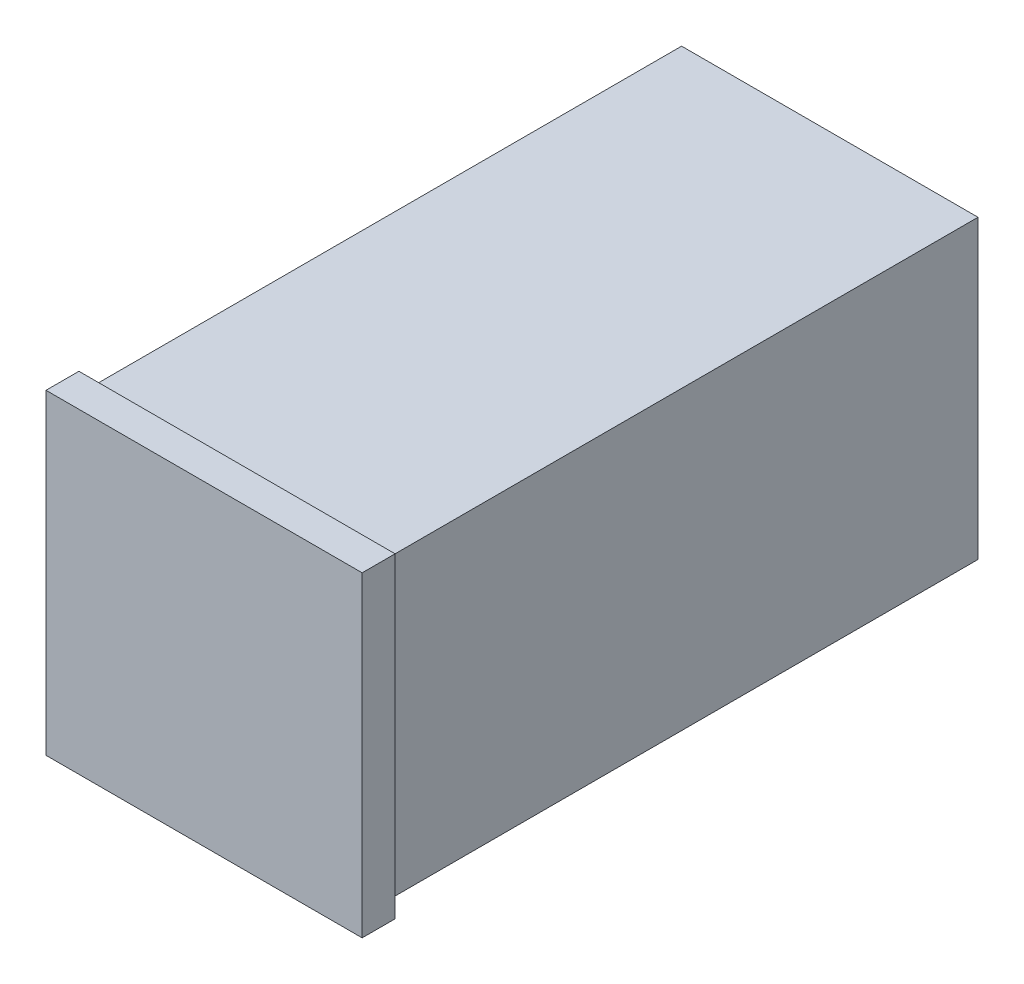
from build123d import *

# Parameters (mm, degrees)
SKETCH1_W           = 48
SKETCH1_H           = 48
BOSS_EXTRUDE1_DEPTH = 5
SKETCH1_2_W         = 45
SKETCH1_2_H         = 45
BOSS_EXTRUDE2_DEPTH = 90


with BuildPart() as part:
    # Sketch1 → Boss-Extrude1 (new body)
    with BuildSketch(Plane.XY):
        with Locations((22.5, 22.5)):
            Rectangle(SKETCH1_W, SKETCH1_H)
    extrude(amount=BOSS_EXTRUDE1_DEPTH)


with BuildPart() as body_2:
    # Sketch1<2> → Boss-Extrude2 (new body)
    with BuildSketch(Plane.XY):
        with Locations((22.5, 22.5)):
            Rectangle(SKETCH1_2_W, SKETCH1_2_H)
    extrude(amount=-BOSS_EXTRUDE2_DEPTH)


solid = Compound([part.part, body_2.part])
